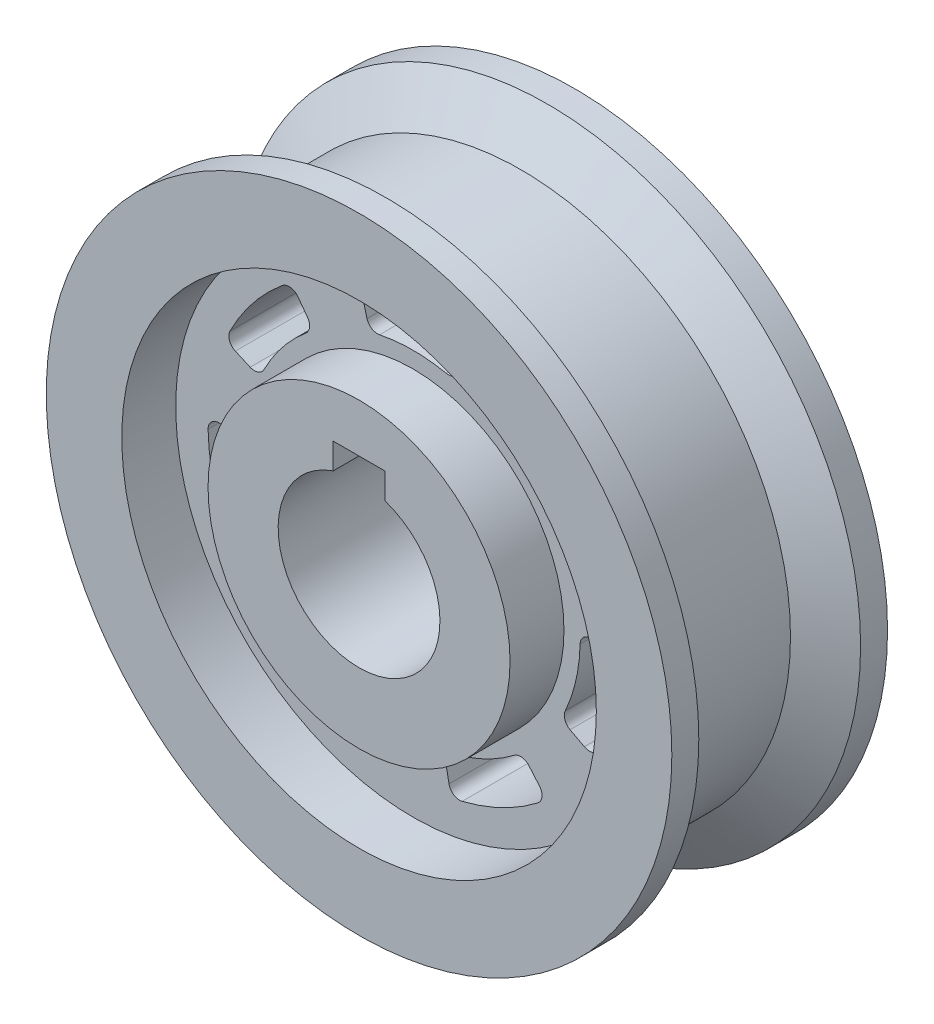
from build123d import *

# Parameters (mm, degrees)
CUT_EXTRUDE1_DEPTH      = 58.948751496
CUT_EXTRUDE1_DEPTH_BACK = 58.948751496
CUT_EXTRUDE2_DEPTH      = 56.459898125
CIRPATTERN1_COUNT       = 7


with BuildPart() as part:
    # Sketch2 → Revolve3 (revolve)
    with BuildSketch(Plane(origin=(0, 0, 0), x_dir=(0, 0, -1), z_dir=(1, 0, 0)), mode=Mode.PRIVATE) as revolve3_sk:
        Polygon((12.7, 0), (12.7, 17.78), (6.35, 17.78), (6.35, 27.94), (12.7, 27.94), (12.7, 36.83), (9.525, 36.83), (6.35, 31.75), (-6.35, 31.75), (-9.525, 36.83), (-12.7, 36.83), (-12.7, 27.94), (-6.35, 27.94), (-6.35, 17.78), (-12.7, 17.78), (-12.7, 0), align=None)
    revolve(revolve3_sk.sketch.rotate(Axis((0, 0, 0), (0, 0, -1)), 90), axis=Axis((0, 0, 0), (0, 0, -1)))

    # Sketch3 → Cut-Extrude1 (cut, two sides: drawn at the far end of the back side and taken through both)
    with BuildSketch(Plane.XY.offset(12.7).offset(-CUT_EXTRUDE1_DEPTH_BACK)):
        with BuildLine():
            Line((-3.048, 12.065), (3.048, 12.065))
            Line((3.048, 12.065), (3.048, 9.024152093))
            ThreePointArc((3.048, 9.024152093), (0, -9.525), (-3.048, 9.024152093))
            Line((-3.048, 9.024152093), (-3.048, 12.065))
        make_face()
    extrude(amount=CUT_EXTRUDE1_DEPTH + CUT_EXTRUDE1_DEPTH_BACK, mode=Mode.SUBTRACT)

    # Sketch4 → Cut-Extrude2 (cut, through all)
    with BuildSketch(Plane.XY.offset(6.35)):
        with BuildLine():
            Line((-5.907465754, 22.046962339), (-5.413583315, 20.203767983))
            ThreePointArc((-5.413583315, 20.203767983), (-4.854909812, 19.452372744), (-3.933108575, 19.28807616))
            ThreePointArc((-3.933108575, 19.28807616), (0, 19.685), (3.933108575, 19.28807616))
            ThreePointArc((3.933108575, 19.28807616), (4.854909812, 19.452372744), (5.413583315, 20.203767983))
            Line((5.413583315, 20.203767983), (5.907465754, 22.046962339))
            ThreePointArc((5.907465754, 22.046962339), (5.762521779, 23.040980559), (4.940781063, 23.618754889))
            ThreePointArc((4.940781063, 23.618754889), (0, 24.13), (-4.940781063, 23.618754889))
            ThreePointArc((-4.940781063, 23.618754889), (-5.762521779, 23.040980559), (-5.907465754, 22.046962339))
        make_face()
    cut_extrude2 = extrude(amount=-CUT_EXTRUDE2_DEPTH, mode=Mode.SUBTRACT)

    # CirPattern1: Cut-Extrude2 ×7 about axis
    cirpattern1_axis = Axis((0, 0, 0), (0, 0, 1))
    for i in range(1, CIRPATTERN1_COUNT):
        add(cut_extrude2.rotate(cirpattern1_axis, i * 360 / CIRPATTERN1_COUNT), mode=Mode.SUBTRACT)


solid = part.part
